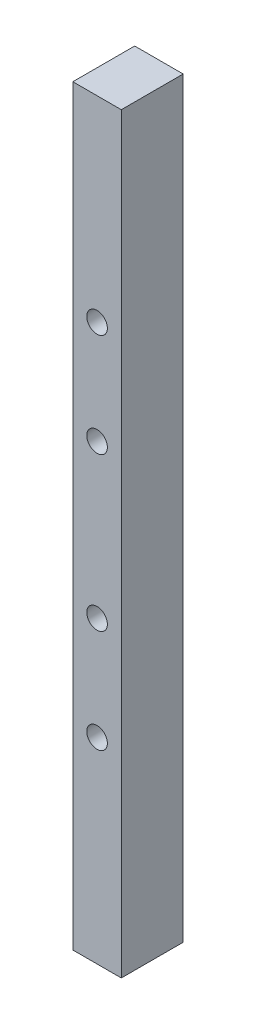
from build123d import *

# Parameters (mm, degrees)
SKETCH1_W           = 4.7
SKETCH1_H           = 72.931211718
SKETCH1_R           = 1
BOSS_EXTRUDE1_DEPTH = 6


with BuildPart() as part:
    # Sketch1 → Boss-Extrude1 (new body)
    with BuildSketch(Plane.XY):
        with Locations((-5.665336409, -7.482469074)):
            Rectangle(SKETCH1_W, SKETCH1_H)
        with Locations((-5.665336409, 9.948742644)):
            Circle(SKETCH1_R, mode=Mode.SUBTRACT)
        with Locations((-5.665336409, -0.051257356)):
            Circle(SKETCH1_R, mode=Mode.SUBTRACT)
        with Locations(Location((-5.665336409, -14.913680791, 0), (0, 0, 180))):
            Circle(SKETCH1_R, mode=Mode.SUBTRACT)
        with Locations(Location((-5.665336409, -24.913680791, 0), (0, 0, 180))):
            Circle(SKETCH1_R, mode=Mode.SUBTRACT)
    extrude(amount=BOSS_EXTRUDE1_DEPTH)


solid = part.part
